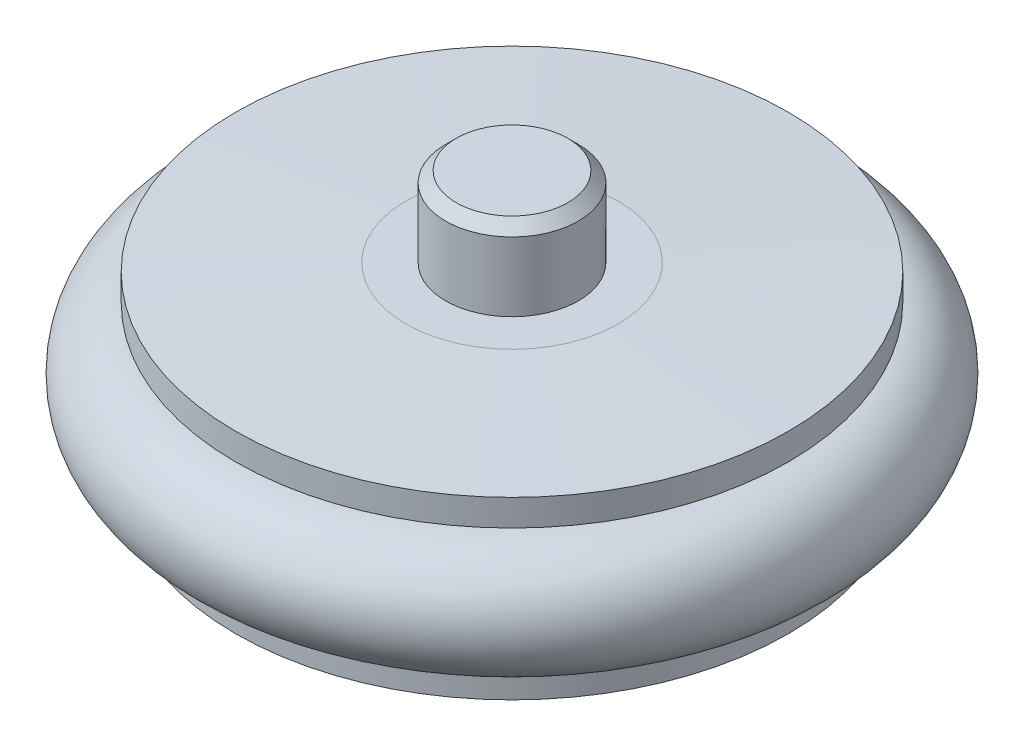
from build123d import *

# Parameters (mm, degrees)
SKETCH2_R = 1.1


with BuildPart() as part:
    # Sketch1 → Revolve1 (revolve)
    with BuildSketch(Plane.XY, mode=Mode.PRIVATE) as revolve1_sk:
        Polygon((1.05, 3.3), (0, 3.3), (0, -3.3), (1.05, -3.3), (1.25, -3.1), (1.25, -1.8), (2, -1.8), (5.2, -1.65), (5.2, -1.15), (3.9, -1.15), (3.9, 1.15), (5.2, 1.15), (5.2, 1.65), (2, 1.8), (1.25, 1.8), (1.25, 3.1), align=None)
    revolve(revolve1_sk.sketch.rotate(Axis((0, 3.3, 0), (0, -1, 0)), 270), axis=Axis((0, 3.3, 0), (0, -1, 0)))


with BuildPart() as body_2:
    # Sketch2 → Revolve2 (revolve)
    with BuildSketch(Plane.XY, mode=Mode.PRIVATE) as revolve2_sk:
        with Locations((5.1, 0)):
            Circle(SKETCH2_R)
    revolve(revolve2_sk.sketch.rotate(Axis((0, 5.52014141, 0), (0, -1, 0)), 90), axis=Axis((0, 5.52014141, 0), (0, -1, 0)))


solid = Compound([part.part, body_2.part])
